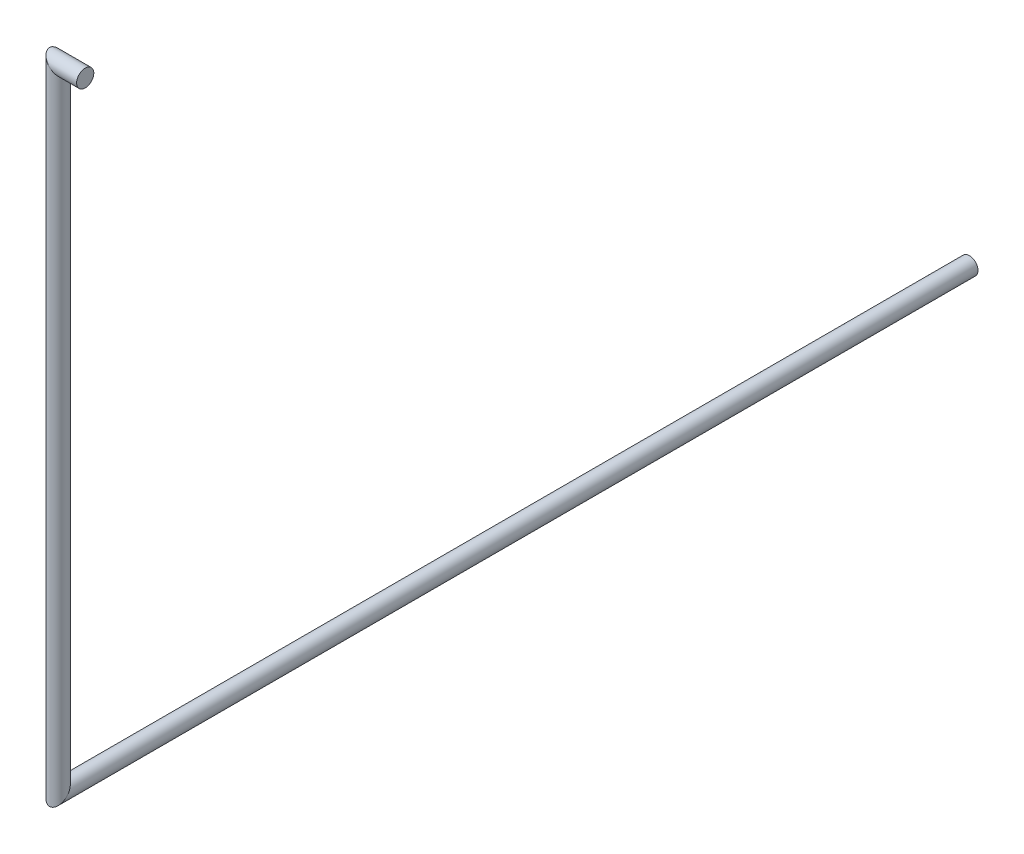
from build123d import *

# Parameters (mm, degrees)
CROQUIS1_R              = 9.525
SALIENTE_EXTRUIR1_DEPTH = 10
CROQUIS2_R              = 9.525


with BuildPart() as part:
    # Croquis1 → Saliente-Extruir1 (new body)
    with BuildSketch(Plane.XY):
        Circle(CROQUIS1_R)
    extrude(amount=SALIENTE_EXTRUIR1_DEPTH)

    # Barrer1: sweep along a curve in space
    with BuildLine() as barrer1_path:
        Line((0, 0, 10), (0, 0, 1010))
        Line((0, 0, 1010), (0, 700, 1010))
        Line((0, 700, 1010), (30, 700, 1010))
    # Croquis2 → Barrer1 (sweep)
    with BuildSketch(Plane.XY.offset(10)):
        Circle(CROQUIS2_R)
    sweep(path=barrer1_path.line, transition=Transition.RIGHT)


solid = part.part
